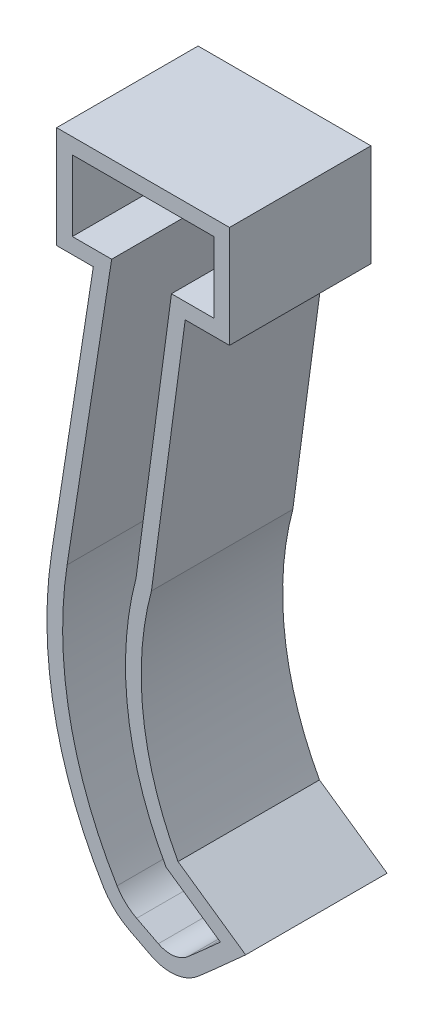
from build123d import *

# Parameters (mm, degrees)
EXTRUDE_1_DEPTH = 16
EXTRUDE_START   = 2
EXTRUDE_2_DEPTH = 2


with BuildPart() as part:
    # 草图2 → 凸台-拉伸1 (new body)
    with BuildSketch(Plane.XY):
        with BuildLine():
            Line((-48.762908832, 54.887448723), (-26.762908832, 54.887448723))
            Line((-26.762908832, 54.887448723), (-26.762908832, 41.887448723))
            Line((-26.762908832, 41.887448723), (-32.402449776, 41.887448723))
            Line((-32.402449776, 41.887448723), (-36.699855568, 9.854978503))
            ThreePointArc((-36.699855568, 9.854978503), (-37.727531794, -4.542394165), (-33.311876123, -18.284389767))
            Line((-33.311876123, -18.284389767), (-24.708766903, -24.263803058))
            Line((-24.708766903, -24.263803058), (-28.738435498, -27.878766712))
            Line((-28.738435498, -27.878766712), (-30.734862705, -29.630628791))
            ThreePointArc((-30.734862705, -29.630628791), (-33.621940029, -30.923968409), (-36.736058642, -30.367005118))
            Line((-36.736058642, -30.367005118), (-39.496815638, -28.94354271))
            ThreePointArc((-39.496815638, -28.94354271), (-41.356176764, -27.633440822), (-42.78903224, -25.866942609))
            ThreePointArc((-42.78903224, -25.866942609), (-49.053565639, -9.682339493), (-49.408404924, 7.668736722))
            Line((-49.408404924, 7.668736722), (-44.097278331, 41.887448723))
            Line((-44.097278331, 41.887448723), (-48.762908832, 41.887448723))
            Line((-48.762908832, 41.887448723), (-48.762908832, 54.887448723))
        make_face()
        with BuildLine():
            Line((-30.065808903, -26.382705226), (-32.053997966, -28.127338346))
            ThreePointArc((-32.053997966, -28.127338346), (-33.865522987, -28.938856991), (-35.819507294, -28.589384904))
            Line((-35.819507294, -28.589384904), (-38.580264289, -27.165922497))
            ThreePointArc((-38.580264289, -27.165922497), (-39.990623798, -26.172186191), (-41.077470951, -24.832264904))
            ThreePointArc((-41.077470951, -24.832264904), (-47.091423014, -9.295045913), (-47.432068727, 7.361987253))
            Line((-47.432068727, 7.361987253), (-41.762908832, 43.887448723))
            Line((-41.762908832, 43.887448723), (-46.762908832, 43.887448723))
            Line((-46.762908832, 43.887448723), (-46.762908832, 52.887448723))
            Line((-46.762908832, 52.887448723), (-28.762908832, 52.887448723))
            Line((-28.762908832, 52.887448723), (-28.762908832, 43.887448723))
            Line((-28.762908832, 43.887448723), (-34.152052224, 43.887448723))
            Line((-34.152052224, 43.887448723), (-38.66514404, 10.247274583))
            ThreePointArc((-38.66514404, 10.247274583), (-39.67581399, -5.082301073), (-34.833871303, -19.66218223))
            Line((-34.833871303, -19.66218223), (-27.926153972, -24.463248422))
            Line((-27.926153972, -24.463248422), (-30.065808903, -26.382705226))
        make_face(mode=Mode.SUBTRACT)
    extrude(amount=EXTRUDE_1_DEPTH)

    # 草图3 → 凸台-拉伸2 (add)
    with BuildSketch(Plane(origin=(0, 0, 0), x_dir=(-1, 0, 0), z_dir=(0, 0, -1)).offset(EXTRUDE_START)):
        with BuildLine():
            Line((24.708766903, -24.263803058), (33.311876123, -18.284389767))
            ThreePointArc((33.311876123, -18.284389767), (37.727531794, -4.542394165), (36.699855568, 9.854978503))
            Line((36.699855568, 9.854978503), (32.402449776, 41.887448723))
            Line((32.402449776, 41.887448723), (26.762908832, 41.887448723))
            Line((26.762908832, 41.887448723), (26.762908832, 54.887448723))
            Line((26.762908832, 54.887448723), (48.762908832, 54.887448723))
            Line((48.762908832, 54.887448723), (48.762908832, 41.887448723))
            Line((48.762908832, 41.887448723), (44.097278331, 41.887448723))
            Line((44.097278331, 41.887448723), (49.408404924, 7.668736722))
            ThreePointArc((49.408404924, 7.668736722), (49.053565639, -9.682339493), (42.78903224, -25.866942609))
            ThreePointArc((42.78903224, -25.866942609), (41.356176764, -27.633440822), (39.496815638, -28.94354271))
            Line((39.496815638, -28.94354271), (36.736058642, -30.367005118))
            ThreePointArc((36.736058642, -30.367005118), (33.621940029, -30.923968409), (30.734862705, -29.630628791))
            Line((30.734862705, -29.630628791), (28.738435498, -27.878766712))
            Line((28.738435498, -27.878766712), (24.708766903, -24.263803058))
        make_face()
    extrude(amount=-EXTRUDE_2_DEPTH)


solid = part.part
